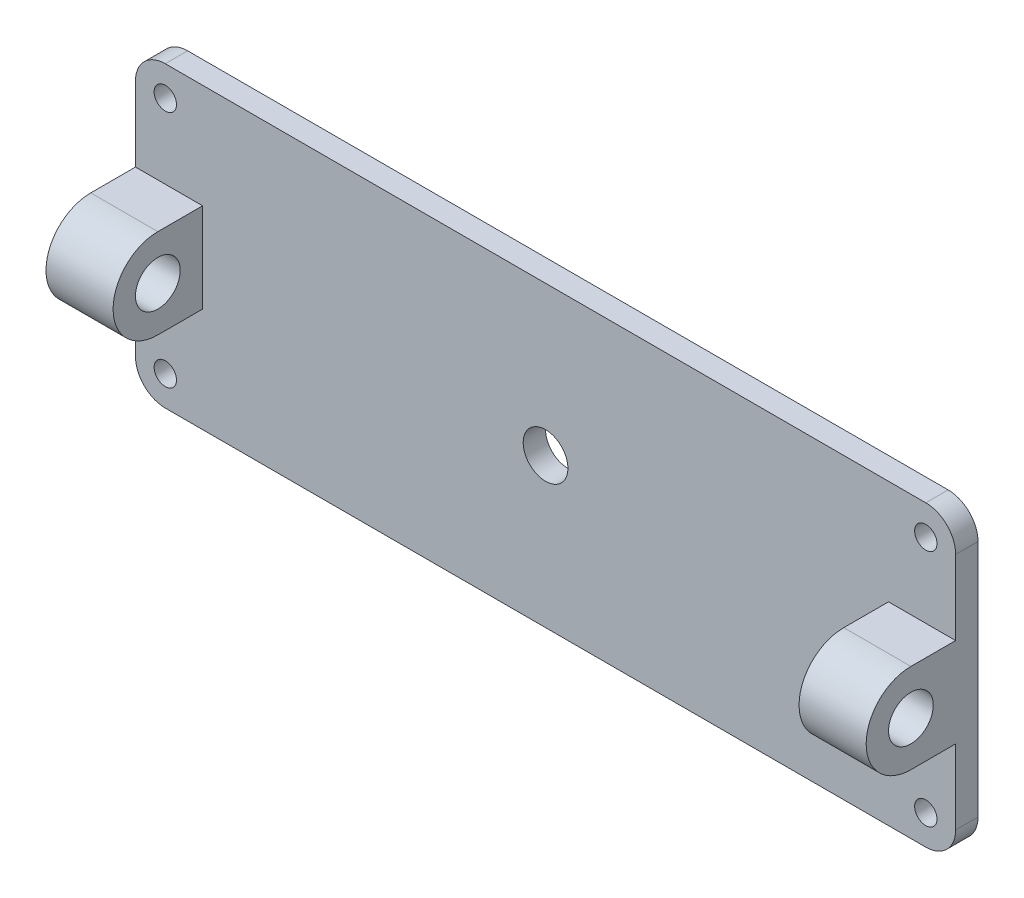
from build123d import *
from build123d.topology import SkipClean

# Parameters (mm, degrees)
BOSS_EXTRUDE1_DEPTH = 349.25
BOSS_EXTRUDE2_START = 349.25
BOSS_EXTRUDE2_DEPTH = 57.15
SKETCH4_R           = 9.525
CUT_EXTRUDE1_DEPTH  = 384.636709662


with BuildPart() as part:
    # Sketch2 → Boss-Extrude1 (new body)
    with BuildSketch(Plane.YZ):
        Polygon((0, 19.05), (0, 0), (127, 0), (127, 19.05), (38.1, 19.05), align=None)
    extrude(amount=BOSS_EXTRUDE1_DEPTH)

    # Sketch2<3> → Boss-Extrude2 (add)
    with BuildSketch(Plane.YZ.offset(BOSS_EXTRUDE2_START)):
        with BuildLine():
            Line((0, 38.1), (0, 19.05))
            Line((0, 19.05), (38.1, 19.05))
            Line((38.1, 19.05), (38.1, 57.15))
            ThreePointArc((38.1, 57.15), (26.940768363, 84.090768363), (0, 95.25))
            Line((0, 95.25), (0, 76.2))
            ThreePointArc((0, 76.2), (13.470384182, 70.620384182), (19.05, 57.15))
            ThreePointArc((19.05, 57.15), (13.470384182, 43.679615818), (0, 38.1))
        make_face()
    extrude(amount=-BOSS_EXTRUDE2_DEPTH)

    # Sketch4 → Cut-Extrude1 (cut, through all)
    with BuildSketch(Plane(origin=(0, 0, 0), x_dir=(1, 0, 0), z_dir=(0, 0, -1))):
        with Locations(Location((323.85, -101.6, 0), (0, 0, 180))):
            Circle(SKETCH4_R)
        with BuildLine():
            Line((323.85, -127), (349.25, -127))
            Line((349.25, -127), (349.25, -101.6))
            ThreePointArc((349.25, -101.6), (341.810512242, -119.560512242), (323.85, -127))
        make_face()
        with BuildLine():
            Line((0, 0), (0, -19.05))
            ThreePointArc((0, -19.05), (13.470384182, -13.470384182), (19.05, 0))
            Line((19.05, 0), (0, 0))
        make_face()
        with BuildLine():
            ThreePointArc((19.05, 0), (-13.470384182, 13.470384182), (0, -19.05))
            Line((0, -19.05), (0, 0))
            Line((0, 0), (19.05, 0))
        make_face()
    extrude(amount=-CUT_EXTRUDE1_DEPTH, mode=Mode.SUBTRACT)

    # Mirror1: part across plane


with BuildPart() as part_1:
    with SkipClean():  # the faces are left unmerged after this step: merging them gives an invalid solid
        add(part.part)
        add(part.part.mirror(Plane(origin=(349.25, 0, 0), x_dir=(0, 0, 1), z_dir=(0, 1, 0))))

    # Mirror2: part across plane


with BuildPart() as part_2:
    with SkipClean():  # the faces are left unmerged after this step: merging them gives an invalid solid
        add(part_1.part)
        add(part_1.part.mirror(Plane(origin=(0, 0, 0), x_dir=(0, 0, 1), z_dir=(1, 0, 0))))


solid = part_2.part
